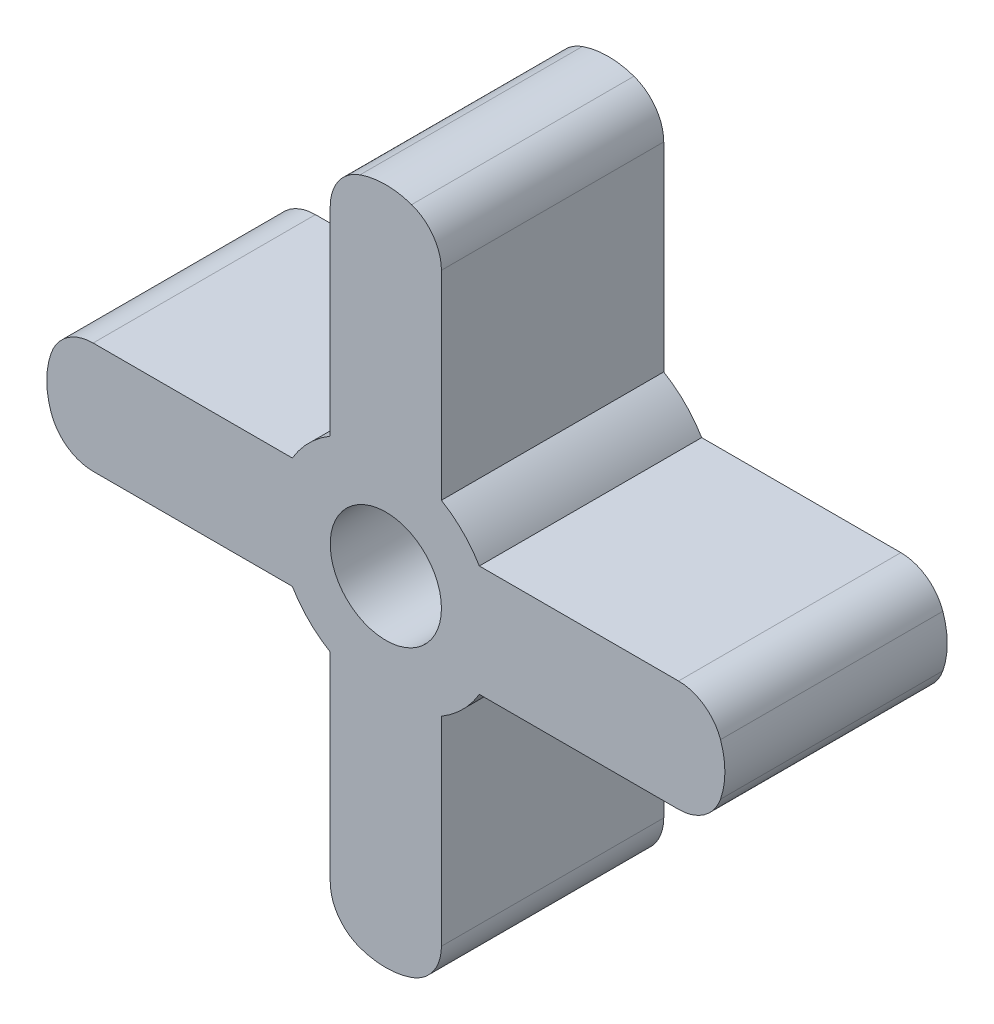
from build123d import *

# Parameters (mm, degrees)
BOSS_EXTRUDE1_DEPTH     = 10
FILLET1_R               = 2
CUT_EXTRUDE1_DEPTH      = 24.772357897
CUT_EXTRUDE1_DEPTH_BACK = 24.772357897
SKETCH4_R               = 2.5


with BuildPart() as part:
    # Sketch3 → Boss-Extrude1 (new body)
    with BuildSketch(Plane.XY):
        with BuildLine():
            Line((-2.5, 4.205809256), (-2.5, 14.205809256))
            ThreePointArc((-2.5, 14.205809256), (0, 15.25), (2.5, 14.205809256))
            Line((2.5, 14.205809256), (2.5, 4.205809256))
            ThreePointArc((2.5, 4.205809256), (3.459684342, 3.459684342), (4.205809256, 2.5))
            Line((4.205809256, 2.5), (14.205809256, 2.5))
            ThreePointArc((14.205809256, 2.5), (15.25, 0), (14.205809256, -2.5))
            Line((14.205809256, -2.5), (4.205809256, -2.5))
            ThreePointArc((4.205809256, -2.5), (3.459684342, -3.459684342), (2.5, -4.205809256))
            Line((2.5, -4.205809256), (2.5, -14.205809256))
            ThreePointArc((2.5, -14.205809256), (0, -15.25), (-2.5, -14.205809256))
            Line((-2.5, -14.205809256), (-2.5, -4.205809256))
            ThreePointArc((-2.5, -4.205809256), (-3.459684342, -3.459684342), (-4.205809256, -2.5))
            Line((-4.205809256, -2.5), (-14.205809256, -2.5))
            ThreePointArc((-14.205809256, -2.5), (-15.25, 0), (-14.205809256, 2.5))
            Line((-14.205809256, 2.5), (-4.205809256, 2.5))
            ThreePointArc((-4.205809256, 2.5), (-3.459684342, 3.459684342), (-2.5, 4.205809256))
        make_face()
    extrude(amount=BOSS_EXTRUDE1_DEPTH)

    # Fillet1
    fillet1_edges = [part.edges().sort_by_distance(p)[0] for p in [
        (-2.5, 14.205809256, 5),
        (2.5, 14.205809256, 5),
        (14.205809256, 2.5, 5),
        (14.205809256, -2.5, 5),
        (2.5, -14.205809256, 5),
        (-2.5, -14.205809256, 5),
        (-14.205809256, -2.5, 5),
        (-14.205809256, 2.5, 5),
    ]]
    fillet(fillet1_edges, radius=FILLET1_R)

    # Sketch4 → Cut-Extrude1 (cut, two sides: drawn at the far end of the back side and taken through both)
    with BuildSketch(Plane.XY.offset(-CUT_EXTRUDE1_DEPTH_BACK)):
        Circle(SKETCH4_R)
    extrude(amount=CUT_EXTRUDE1_DEPTH + CUT_EXTRUDE1_DEPTH_BACK, mode=Mode.SUBTRACT)


solid = part.part
